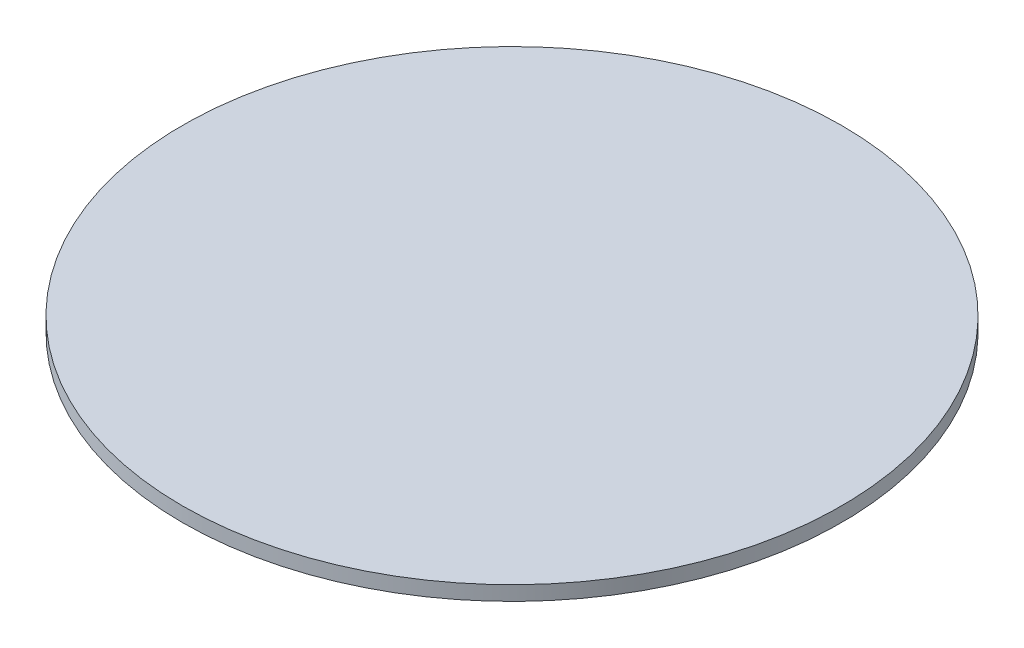
from build123d import *

# Parameters (mm, degrees)
SKETCH1_R           = 25
BOSS_EXTRUDE1_DEPTH = 1.1


with BuildPart() as part:
    # Sketch1 → Boss-Extrude1 (new body)
    with BuildSketch(Plane(origin=(0, 0, 0), x_dir=(1, 0, 0), z_dir=(0, 1, 0))):
        with Locations(Location((0, 0, 0), (0, 0, 270))):
            Circle(SKETCH1_R)
    extrude(amount=BOSS_EXTRUDE1_DEPTH)


solid = part.part
